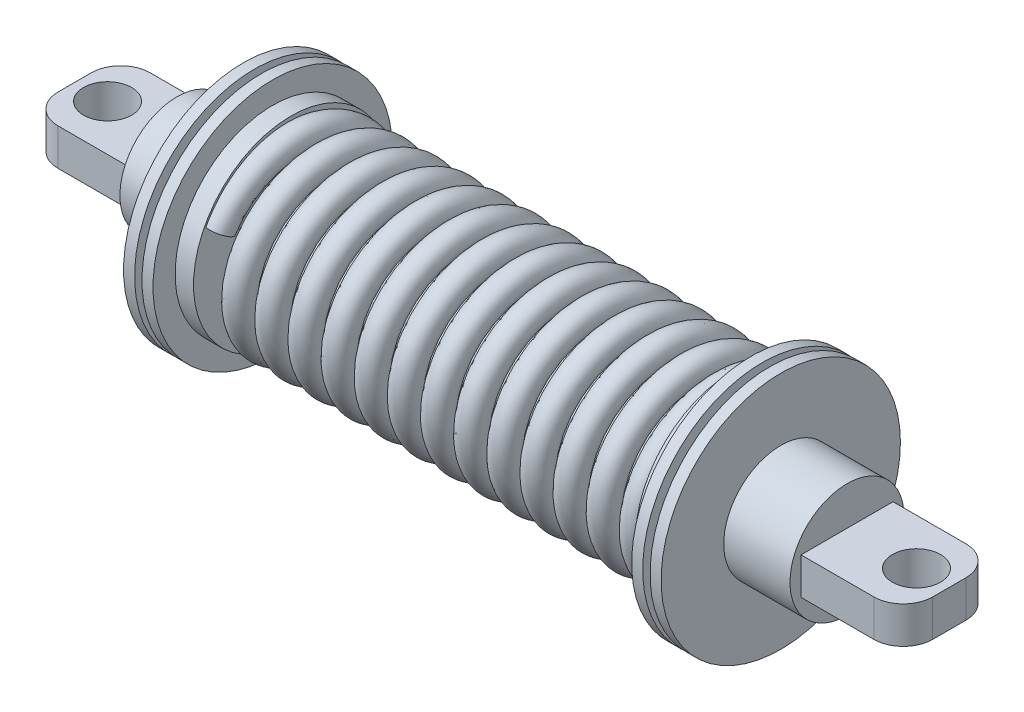
from build123d import *

# Parameters (mm, degrees)
SKETCH2_R           = 6.533658311
BOSS_EXTRUDE1_DEPTH = 5
SWEEP1_PROFILE_R    = 3.5


with BuildPart() as part:
    # Sketch1 → Revolve1 (revolve)
    with BuildSketch(Plane.XY, mode=Mode.PRIVATE) as revolve1_sk:
        Polygon((-60, 13), (60, 13), (60, 26.5), (65, 26.5), (65, 32.5), (68, 32.5), (68, 18.5), (70, 18.5), (70, 32.5), (73, 32.5), (73, 15.5), (91, 15.5), (91, 0), (-91, 0), (-91, 15.5), (-73, 15.5), (-73, 32.5), (-70, 32.5), (-70, 18.5), (-68, 18.5), (-68, 32.5), (-65, 32.5), (-65, 26.5), (-60, 26.5), align=None)
    revolve(revolve1_sk.sketch.rotate(Axis((0, 0, 0), (-1, 0, 0)), 90), axis=Axis((0, 0, 0), (-1, 0, 0)))

    # Sketch2 → Boss-Extrude1 (add, symmetric)
    with BuildSketch(Plane(origin=(0, 0, 0), x_dir=(1, 0, 0), z_dir=(0, 1, 0))):
        with BuildLine():
            Line((91, -12.5), (110.773980499, -12.5))
            ThreePointArc((110.773980499, -12.5), (116.430834749, -10.156854249), (118.773980499, -4.5))
            Line((118.773980499, -4.5), (118.773980499, 4.5))
            ThreePointArc((118.773980499, 4.5), (116.430834749, 10.156854249), (110.773980499, 12.5))
            Line((110.773980499, 12.5), (91, 12.5))
            Line((91, 12.5), (91, -12.5))
        make_face()
        with Locations(Location((109.851069952, 0, 0), (0, 0, 270))):
            Circle(SKETCH2_R, mode=Mode.SUBTRACT)
    boss_extrude1 = extrude(amount=BOSS_EXTRUDE1_DEPTH, both=True)

    # Mirror1: Boss-Extrude1 across plane
    add(boss_extrude1.mirror(Plane(origin=(0, 0, 0), x_dir=(0, 0, 1), z_dir=(1, 0, 0))))

    # Sweep1: sweep along a curve in space
    with BuildLine() as sweep1_path:
        add(Edge.make_bspline(
            [(60, 15.909902577, -15.909902577), (59.857521068, 17.492445618, -14.327359536), (59.570720923, 20.198403965, -10.662717891), (59.142001619, 22.442784126, -4.232310593), (58.712885505, 22.693055042, 2.579248447), (58.283875716, 20.921492983, 9.159991211), (57.854837437, 17.287302437, 14.925398349), (57.425806793, 12.11369632, 19.361703646), (56.996774102, 5.861458589, 22.073984717), (56.56774196, -0.912713632, 22.820700781), (56.138709671, -7.605612461, 21.535368656), (55.709677421, -13.621276461, 18.33243763), (55.280645161, -18.424045439, 13.497110494), (54.851612903, -21.586261085, 7.459944671), (54.422580645, -22.826346573, 0.758514466), (53.993548387, -22.033879563, -6.010457013), (53.564516129, -19.279424598, -12.244232489), (53.135483871, -14.808249766, -17.387730759), (52.706451613, -9.018487003, -20.982953421), (52.277419355, -2.425680781, -22.709766948), (51.848387097, 4.383118111, -22.414408707), (51.419354839, 10.801626001, -20.123178621), (50.990322581, 16.258312345, -16.040097312), (50.561290323, 20.267291177, -10.528739261), (50.132258065, 22.471586406, -4.079858631), (49.703225806, 22.674918451, 2.73230952), (49.274193548, 20.859181783, 9.301181507), (48.84516129, 17.186057119, 15.041837746), (48.416129032, 11.982614704, 19.443106412), (47.987096774, 5.712190615, 22.113080302), (47.558064516, -1.066870601, 22.814013877), (47.129032258, -7.750933236, 21.483493106), (46.7, -13.744820653, 18.239993072), (46.270967742, -18.514812275, 13.372328461), (45.841935484, -21.636168279, 7.313936304), (45.412903226, -22.830950191, 0.604280946), (44.983870968, -21.992769676, -6.159182092), (44.55483871, -19.196261803, -12.37420603), (44.125806452, -14.690439221, -17.487379379), (43.696774194, -8.876519048, -21.043403994), (43.267741935, -2.272196831, -22.725636705), (42.838709677, 4.534451209, -22.384284539), (42.409677419, 10.93733292, -20.049742908), (41.980645161, 16.36630918, -15.929889074), (41.551612903, 20.337961441, -10.391571897), (41.122580645, 22.498637327, -3.927946091), (40.693548387, 22.655941302, 2.885440313), (40.264516129, 20.795866368, 9.441895154), (39.835483871, 17.084041305, 15.157604519), (39.406451613, 11.850982402, 19.523617958), (38.977419355, 5.56266291, 22.151167541), (38.548387097, -1.220979141, 22.806285362), (38.119354839, -7.895900149, 21.430637016), (37.690322581, -13.867737484, 18.146715933), (37.261290323, -18.604734, 13.246936055), (36.832258065, -21.685087895, 7.167594091), (36.403225806, -22.834511692, 0.450019843), (35.974193548, -21.950655932, -6.307626036), (35.54516129, -19.112222796, -12.503614752), (35.116129032, -14.571958133, -17.586229791), (34.687096774, -8.734145926, -21.102894044), (34.258064516, -2.118609167, -22.740469152), (33.829032258, 4.685577332, -22.353138642), (33.4, 11.072540606, -19.975392026), (32.970967742, 16.473558976, -15.818953718), (32.541935484, 20.407703381, -10.253930211), (32.112903226, 22.5246613, -3.775854261), (31.683870968, 22.635930025, 3.038439401), (31.25483871, 20.731601728, 9.582177826), (30.825806452, 16.981245692, 15.272679425), (30.396774194, 11.718809164, 19.603238351), (29.967741935, 5.412881299, 22.188243691), (29.538709677, -1.375031949, 22.797515856), (29.109677419, -8.040506654, 21.376802727), (28.680645161, -13.990021323, 18.052610488), (28.251612903, -18.693806514, 13.120938995), (27.822580645, -21.733017697, 7.020924714), (27.393548387, -22.837030914, 0.2957382), (26.964516129, -21.907540253, -6.45578207), (26.535483871, -19.027311414, -12.632452748), (26.106451613, -14.452811909, -17.68427748), (25.677419355, -8.591374134, -21.161420854), (25.248387097, -1.9649248, -22.754263614), (24.819354839, 4.836489582, -22.320972438), (24.390322581, 11.207242888, -19.90012937), (23.961290323, 16.580056839, -15.707296308), (23.532258065, 20.476513814, -10.115820485), (23.103225806, 22.549657137, -3.623590082), (22.674193548, 22.614885533, 3.191299799), (22.24516129, 20.666390796, 9.72202312), (21.816129032, 16.877674972, 15.387057211), (21.387096774, 11.586101021, 19.681963957), (20.958064516, 5.262852618, 22.224307062), (20.529032258, -1.529021994, 22.78770576), (20.1, -8.184746151, 21.321992696), (19.670967742, -14.11166659, 17.957681034), (19.241935484, -18.78202575, 12.99434303), (18.812903226, -21.779955498, 6.873934868), (18.383870968, -22.838507743, 0.141443057), (17.95483871, -21.863424607, -6.603643429), (17.525806452, -18.941531532, -12.760714137), (17.096774194, -14.333005989, -17.781517972), (16.667741935, -8.44821019, -21.218981754), (16.238709677, -1.811150743, -22.767019459), (15.809677419, 4.987181072, -22.287787396), (15.380645161, 11.341433615, -19.823958374), (14.951612903, 16.685797906, -15.59492194), (14.522580645, 20.544389599, -9.977249024), (14.093548387, 22.573623697, -3.471160505), (13.664516129, 22.592808787, 3.344014531), (13.235483871, 20.600236549, 9.861424654), (12.806451613, 16.773333872, 15.500732656), (12.377419355, 11.452864032, 19.759791181), (11.948387097, 5.112583714, 22.259356007), (11.519354839, -1.682942248, 22.776855522), (11.090322581, -8.328612056, 21.266209424), (10.661290323, -14.23266773, 17.861931904), (10.232258065, -18.869387684, 12.86715394), (9.803225806, -21.825899155, 6.726631262), (9.374193548, -22.838942111, -0.012858541), (8.94516129, -21.818311006, -6.751203367), (8.516129032, -18.854887066, -12.888393065), (8.087096774, -14.212545839, -17.877946829), (7.658064516, -8.304660628, -21.275574115), (7.229032258, -1.657294017, -22.778736107), (6.8, 5.137644922, -22.253585031), (6.370967742, 11.475106665, -19.746882516), (5.941935484, 16.790777353, -15.481835743), (5.512903226, 20.611327637, -9.838222152), (5.083870968, 22.596559887, -3.318572487), (4.65483871, 22.569700795, 3.496576625), (4.225806452, 20.533142006, 10.000376064), (3.796774194, 16.668227156, 15.613700572), (3.367741935, 11.319104279, 19.836716472), (2.938709677, 4.962081446, 22.293388926), (2.509677419, -1.836785683, 22.764965636), (2.080645161, -8.472097803, 21.20945546), (1.651612903, -14.353019223, 17.765367468), (1.222580645, -18.955888326, 12.73937753), (0.793548387, -21.870846572, 6.57902062), (0.364516129, -22.838333997, -0.167159553), (-0.064516129, -21.772201512, -6.898455146), (-0.493548387, -18.767381971, -13.015483703), (-0.922580645, -14.09143696, -17.97355965), (-1.351612903, -8.160732001, -21.331195355), (-1.780645161, -1.503361644, -22.789413021), (-2.209677419, 5.287874265, -22.218366903), (-2.638709677, 11.608255934, -19.668905314), (-3.067741935, 16.894990386, -15.368042879), (-3.496774194, 20.677324873, -9.698746216), (-3.925806452, 22.618464659, -3.165832993), (-4.35483871, 22.545562611, 3.648979119), (-4.783870968, 20.465110231, 10.138871008), (-5.212903226, 16.562359619, 15.725955803), (-5.641935484, 11.184827866, 19.912736318), (-6.070967742, 4.811352685, 22.326404265), (-6.5, -1.990545279, 22.752036647), (-6.929032258, -8.615196842, 21.151733391), (-7.358064516, -14.472715573, 17.667992133), (-7.787096774, -19.041523728, 12.611019632), (-8.216129032, -21.914795696, 6.431109678), (-8.64516129, -22.83668343, -0.321452935), (-9.074193548, -21.725098227, -7.045392046), (-9.503225806, -18.679020241, -13.141980251), (-9.932258065, -13.969684878, -18.068352068), (-10.361290323, -8.016430879, -21.385842935), (-10.790322581, -1.34936065, -22.799049715), (-11.219354839, 5.437862244, -22.18213462), (-11.648387097, 11.740875346, -19.590030326), (-12.077419355, 16.998432249, -15.253548543), (-12.506451613, 20.742378295, -9.558827581), (-12.935483871, 22.639337014, -3.012948995), (-13.364516129, 22.520395338, 3.801215056), (-13.793548387, 20.396144327, 10.276903165), (-14.222580645, 16.455736096, 15.837493224), (-14.651612903, 11.050040923, 19.987847249), (-15.080645161, 4.660404311, 22.358400518), (-15.509677419, -2.144214016, 22.738069142), (-15.938709677, -8.75790264, 21.093045854), (-16.367741935, -14.591751317, 17.569810345), (-16.796774194, -19.126289983, 12.482086106), (-17.225806452, -21.957744521, 6.28290519), (-17.65483871, -22.833990485, -0.475731644), (-18.083870968, -21.677003303, -7.19200736), (-18.512903226, -18.589805909, -13.267876935), (-18.941935484, -13.847295152, -18.162319759), (-19.370967742, -7.871763847, -21.43951436), (-19.8, -1.195298064, -22.807645749), (-20.229032258, 5.587602011, -22.144889836), (-20.658064516, 11.872958847, -19.510261154), (-21.087096774, 17.10109822, -15.138357961), (-21.516129032, 20.806484934, -9.418472635), (-21.94516129, 22.659175998, -2.859927472), (-22.374193548, 22.494200123, 3.953277486), (-22.803225806, 20.326247444, 10.414466233), (-23.232258065, 16.348361452, 15.948307744), (-23.661290323, 10.914749602, 20.062045838), (-24.090322581, 4.509243212, 22.389376224), (-24.519354839, -2.297784881, 22.723063762), (-24.948387097, -8.900208686, 21.033395528), (-25.377419355, -14.710121023, 17.470826585), (-25.806451613, -19.21018322, 12.352582837), (-26.235483871, -21.999691087, 6.134413919), (-26.664516129, -22.830255285, -0.629988638), (-27.093548387, -21.627918934, -7.338294396), (-27.522580645, -18.499743047, -13.393168007), (-27.951612903, -13.724273368, -18.255458433), (-28.380645161, -7.726737509, -21.492207182), (-28.809677419, -1.04118092, -22.81520073), (-29.238709677, 5.737086734, -22.10663425), (-29.667741935, 12.004500408, -19.429601438), (-30.096774194, 17.202983614, -15.022476389), (-30.525806452, 20.869641862, -9.277687783), (-30.95483871, 22.677980707, -2.706775407), (-31.383870968, 22.466978164, 4.10515947), (-31.812903226, 20.255422772, 10.551553934), (-32.241935484, 16.240240589, 16.058394306), (-32.670967742, 10.778960079, 20.135328696), (-33.1, 4.35787629, 22.41932997), (-33.529032258, -2.451250864, 22.707021189), (-33.958064516, -9.042108482, 20.972785134), (-34.387096774, -14.827819287, 17.371045371), (-34.816129032, -19.29319961, 12.222515735), (-35.24516129, -22.04063348, 5.985642643), (-35.674193548, -22.825478001, -0.784216877), (-36.103225806, -21.577847362, -7.484246476), (-36.532258065, -18.408835766, -13.517847751), (-36.961290323, -13.60062514, -18.347763838), (-37.390322581, -7.581358485, -21.543918993), (-37.819354839, -0.88701625, -22.821714314), (-38.248387097, 5.886309587, -22.06736961), (-38.677419355, 12.135494024, -19.34805486), (-39.106451613, 17.304083779, -14.905909118), (-39.535483871, 20.931846198, -9.136479453), (-39.964516129, 22.695750282, -2.553499792), (-40.393548387, 22.438730701, 4.256854074), (-40.822580645, 20.183673542, 10.68816001), (-41.251612903, 16.131378442, 16.167747883), (-41.680645161, 10.642678551, 20.207692479), (-42.109677419, 4.206310453, 22.448260388), (-42.538709677, -2.60460496, 22.689942157), (-42.967741935, -9.183595552, 20.91121744), (-43.396774194, -14.944840736, 17.270471257), (-43.825806452, -19.375335364, 12.091890738), (-44.25483871, -22.080569831, 5.836598153), (-44.683870968, -22.81965885, -0.93840932), (-45.112903226, -21.52679087, -7.629856938), (-45.541935484, -18.317088216, -13.641910473), (-45.970967742, -13.476356114, -18.439231762), (-46.4, -7.435633411, -21.594647435), (-46.829032258, -0.732811093, -22.827186204), (-47.258064516, 6.035263761, -22.027097707), (-47.687096774, 12.265933718, -19.265625142), (-48.116129032, 17.404394101, -14.788661469), (-48.54516129, 20.993095103, -8.994854089), (-48.974193548, 22.712483912, -2.400107622), (-49.403225806, 22.409459025, 4.408354374), (-49.832258065, 20.111003032, 10.824278227), (-50.261290323, 16.02177998, 16.276363486), (-50.690322581, 10.505911239, 20.279133885), (-51.119354839, 4.05455262, 22.476166157), (-51.548387097, -2.757840168, 22.671827445), (-51.977419355, -9.324663438, 20.848695255), (-52.406451613, -15.06118003, 17.169108834), (-52.835483871, -19.456586733, 11.960713807), (-53.264516129, -22.119498317, 5.687287253), (-53.693548387, -22.812798098, -1.092558929), (-54.122580645, -21.474751791, -7.775119136), (-54.551612903, -18.224504586, -13.765350511), (-54.980645161, -13.351471954, -18.529858032), (-55.409677421, -7.289568963, -21.644390179), (-55.838709671, -0.578572397, -22.831616195), (-56.26774196, 6.183942117, -21.985820207), (-56.696774102, 12.395814797, -19.18231669), (-57.125806793, 17.503905288, -14.670736391), (-57.554837437, 21.05340337, -8.852827119), (-57.983875716, 22.728115185, -2.246572451), (-58.412885505, 22.379409476, 4.55952862), (-58.842001619, 20.036500188, 10.960368264), (-59.270720923, 15.914862675, 16.382497416), (-59.557521068, 12.208906809, 19.031591617), (-59.7, 10.214786244, 20.047646794)],
            knots=[0, 0, 0, 0, 0.003584229, 0.007168459, 0.010752688, 0.014336918, 0.017921147, 0.021505376, 0.025089606, 0.028673835, 0.032258065, 0.035842294, 0.039426523, 0.043010753, 0.046594982, 0.050179211, 0.053763441, 0.05734767, 0.0609319, 0.064516129, 0.068100358, 0.071684588, 0.075268817, 0.078853047, 0.082437276, 0.086021505, 0.089605735, 0.093189964, 0.096774194, 0.100358423, 0.103942652, 0.107526882, 0.111111111, 0.114695341, 0.11827957, 0.121863799, 0.125448029, 0.129032258, 0.132616487, 0.136200717, 0.139784946, 0.143369176, 0.146953405, 0.150537634, 0.154121864, 0.157706093, 0.161290323, 0.164874552, 0.168458781, 0.172043011, 0.17562724, 0.17921147, 0.182795699, 0.186379928, 0.189964158, 0.193548387, 0.197132616, 0.200716846, 0.204301075, 0.207885305, 0.211469534, 0.215053763, 0.218637993, 0.222222222, 0.225806452, 0.229390681, 0.23297491, 0.23655914, 0.240143369, 0.243727599, 0.247311828, 0.250896057, 0.254480287, 0.258064516, 0.261648746, 0.265232975, 0.268817204, 0.272401434, 0.275985663, 0.279569892, 0.283154122, 0.286738351, 0.290322581, 0.29390681, 0.297491039, 0.301075269, 0.304659498, 0.308243728, 0.311827957, 0.315412186, 0.318996416, 0.322580645, 0.326164875, 0.329749104, 0.333333333, 0.336917563, 0.340501792, 0.344086022, 0.347670251, 0.35125448, 0.35483871, 0.358422939, 0.362007168, 0.365591398, 0.369175627, 0.372759857, 0.376344086, 0.379928315, 0.383512545, 0.387096774, 0.390681004, 0.394265233, 0.397849462, 0.401433692, 0.405017921, 0.408602151, 0.41218638, 0.415770609, 0.419354839, 0.422939068, 0.426523297, 0.430107527, 0.433691756, 0.437275986, 0.440860215, 0.444444444, 0.448028674, 0.451612903, 0.455197133, 0.458781362, 0.462365591, 0.465949821, 0.46953405, 0.47311828, 0.476702509, 0.480286738, 0.483870968, 0.487455197, 0.491039427, 0.494623656, 0.498207885, 0.501792115, 0.505376344, 0.508960573, 0.512544803, 0.516129032, 0.519713262, 0.523297491, 0.52688172, 0.53046595, 0.534050179, 0.537634409, 0.541218638, 0.544802867, 0.548387097, 0.551971326, 0.555555556, 0.559139785, 0.562724014, 0.566308244, 0.569892473, 0.573476703, 0.577060932, 0.580645161, 0.584229391, 0.58781362, 0.591397849, 0.594982079, 0.598566308, 0.602150538, 0.605734767, 0.609318996, 0.612903226, 0.616487455, 0.620071685, 0.623655914, 0.627240143, 0.630824373, 0.634408602, 0.637992832, 0.641577061, 0.64516129, 0.64874552, 0.652329749, 0.655913978, 0.659498208, 0.663082437, 0.666666667, 0.670250896, 0.673835125, 0.677419355, 0.681003584, 0.684587814, 0.688172043, 0.691756272, 0.695340502, 0.698924731, 0.702508961, 0.70609319, 0.709677419, 0.713261649, 0.716845878, 0.720430108, 0.724014337, 0.727598566, 0.731182796, 0.734767025, 0.738351254, 0.741935484, 0.745519713, 0.749103943, 0.752688172, 0.756272401, 0.759856631, 0.76344086, 0.76702509, 0.770609319, 0.774193548, 0.777777778, 0.781362007, 0.784946237, 0.788530466, 0.792114695, 0.795698925, 0.799283154, 0.802867384, 0.806451613, 0.810035842, 0.813620072, 0.817204301, 0.82078853, 0.82437276, 0.827956989, 0.831541219, 0.835125448, 0.838709677, 0.842293907, 0.845878136, 0.849462366, 0.853046595, 0.856630824, 0.860215054, 0.863799283, 0.867383513, 0.870967742, 0.874551971, 0.878136201, 0.88172043, 0.885304659, 0.888888889, 0.892473118, 0.896057348, 0.899641577, 0.903225806, 0.906810036, 0.910394265, 0.913978495, 0.917562724, 0.921146953, 0.924731183, 0.928315412, 0.931899642, 0.935483871, 0.9390681, 0.94265233, 0.946236559, 0.949820789, 0.953405018, 0.956989247, 0.960573477, 0.964157706, 0.967741935, 0.971326165, 0.974910394, 0.978494624, 0.982078853, 0.985663082, 0.989247312, 0.992831541, 0.996415771, 1, 1, 1, 1], degree=3))
    # Sweep1 profile (on start of the path) → Sweep1 (sweep)
    with BuildSketch(Plane(origin=(60, 15.909902577, -15.909902577), x_dir=(0, -0.707106781186544, 0.7071067811865511), z_dir=(-0.0635333619109677, 0.7056782240951962, 0.7056782240951891))):
        Circle(SWEEP1_PROFILE_R)
    sweep(path=sweep1_path.line, is_frenet=True)


solid = part.part
